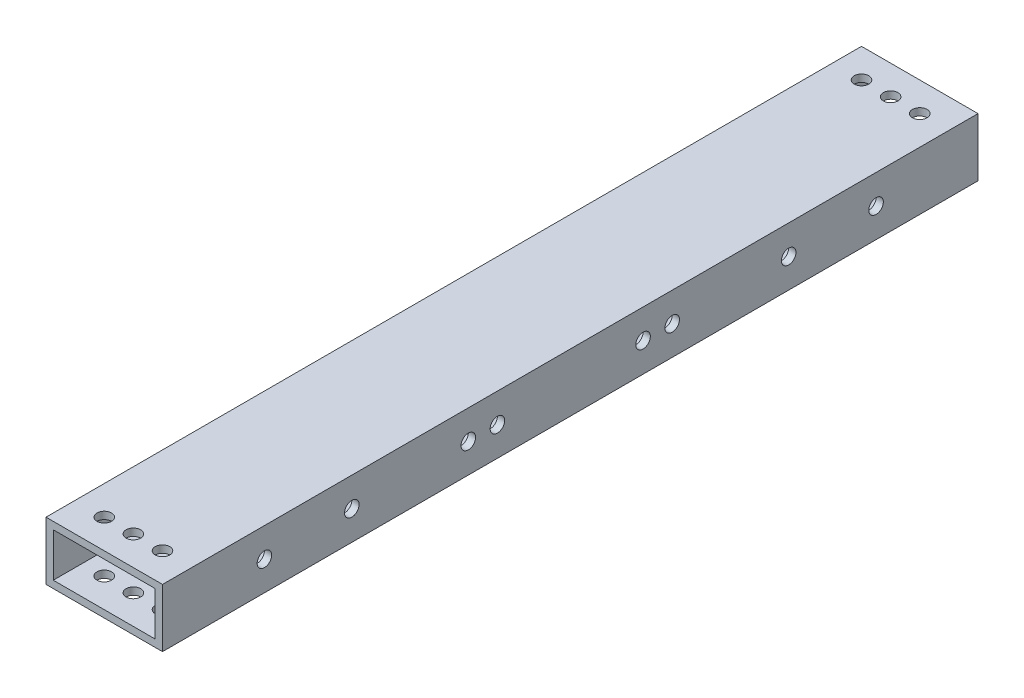
from build123d import *

# Parameters (mm, degrees)
SKETCH1_W                   = 50.8
SKETCH1_H                   = 25.4
SKETCH1_W_2                 = 44.45
SKETCH1_H_2                 = 19.05
BOSS_EXTRUDE1_DEPTH         = 355.6
CUT_EXTRUDE1_DEPTH          = 361.10715072
CUT_EXTRUDE1_DEPTH_BACK     = 361.10715072
SKETCH2_R                   = 3.175
F_1_4_0_25_DIAMETER_HOLE1_D = 6.35


with BuildPart() as part:
    # Sketch1 → Boss-Extrude1 (new body)
    with BuildSketch(Plane.XY):
        with Locations((25.4, 12.7)):
            Rectangle(SKETCH1_W, SKETCH1_H)
        with Locations((25.4, 12.7)):
            Rectangle(SKETCH1_W_2, SKETCH1_H_2, mode=Mode.SUBTRACT)
    extrude(amount=BOSS_EXTRUDE1_DEPTH)

    # Sketch2 → Cut-Extrude1 (cut, two sides: drawn at the far end of the back side and taken through both)
    with BuildSketch(Plane.ZY.offset(-CUT_EXTRUDE1_DEPTH_BACK)):
        with Locations((133.35, 12.7)):
            Circle(SKETCH2_R)
        with Locations((146.05, 12.7)):
            Circle(SKETCH2_R)
        with Locations((82.55, 12.7)):
            Circle(SKETCH2_R)
        with Locations((44.45, 12.7)):
            Circle(SKETCH2_R)
        with Locations((209.55, 12.7)):
            Circle(SKETCH2_R)
        with Locations((222.25, 12.7)):
            Circle(SKETCH2_R)
        with Locations((273.05, 12.7)):
            Circle(SKETCH2_R)
        with Locations((311.15, 12.7)):
            Circle(SKETCH2_R)
    extrude(amount=CUT_EXTRUDE1_DEPTH + CUT_EXTRUDE1_DEPTH_BACK, mode=Mode.SUBTRACT)

    # 1/4 (0.25) Diameter Hole1 (through all)
    with Locations(Plane(origin=(0, 25.4, 0), x_dir=(1, 0, 0), z_dir=(0, 1, 0))):
        with Locations((12.7, -12.7), (25.4, -12.7), (38.1, -12.7), (12.7, -342.9), (25.4, -342.9), (38.1, -342.9)):
            Hole(F_1_4_0_25_DIAMETER_HOLE1_D / 2)


solid = part.part
